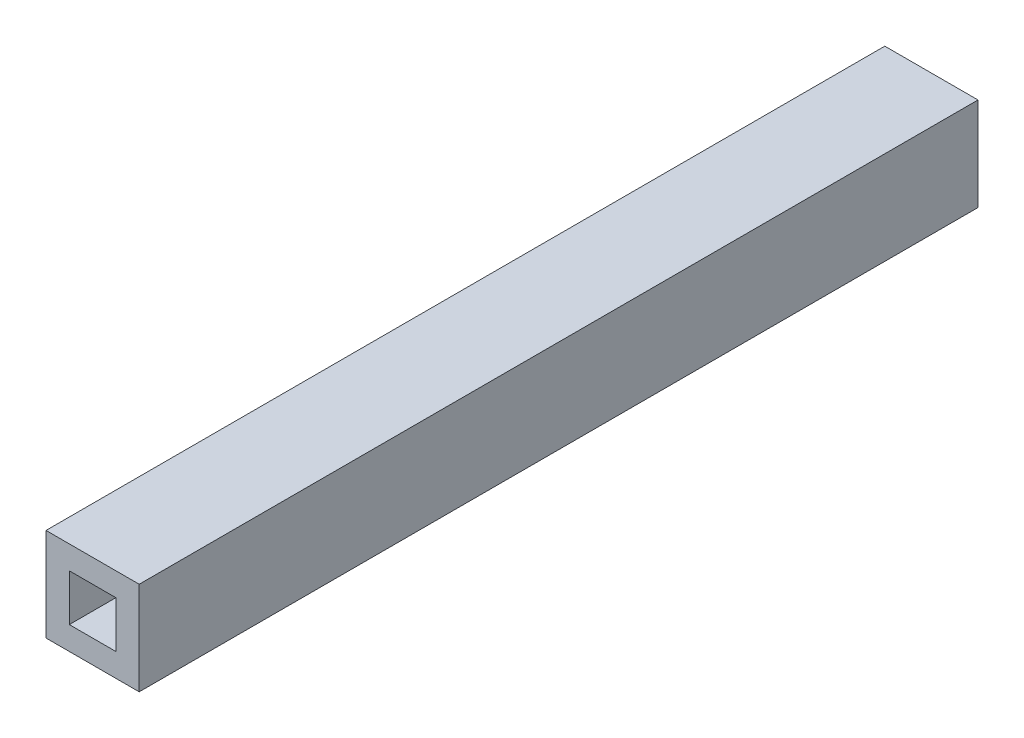
from build123d import *

# Parameters (mm, degrees)
SKETCH1_W           = 20
SKETCH1_H           = 20
SKETCH1_W_2         = 10
SKETCH1_H_2         = 10
EXTRUDE_THIN1_DEPTH = 180


with BuildPart() as part:
    # Sketch1 → Extrude-Thin1 (new body)
    with BuildSketch(Plane.XY):
        Rectangle(SKETCH1_W, SKETCH1_H)
        Rectangle(SKETCH1_W_2, SKETCH1_H_2, mode=Mode.SUBTRACT)
    extrude(amount=EXTRUDE_THIN1_DEPTH)


solid = part.part
